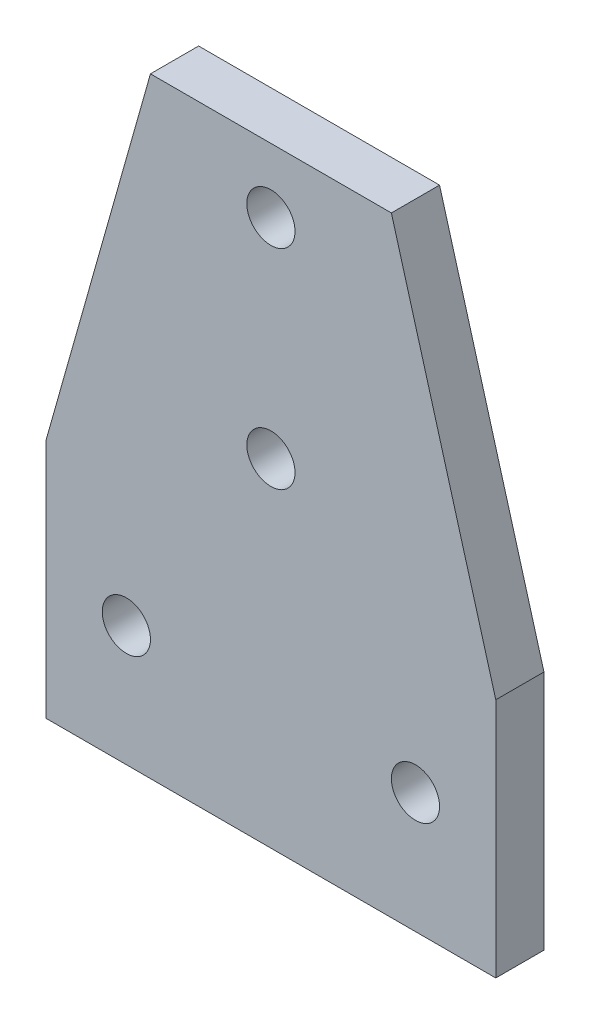
from build123d import *

# Parameters (mm, degrees)
EXTRUDE_1_DEPTH     = 3
SKETCH_2_R          = 1.5
CUT_EXTRUDE_1_DEPTH = 3
SKETCH_3_W          = 11
SKETCH_3_H          = 29.457142857
CUT_EXTRUDE_2_DEPTH = 3
SKETCH_4_W          = 11
SKETCH_4_H          = 29.457142857
CUT_EXTRUDE_3_DEPTH = 3
CUT_EXTRUDE_4_DEPTH = 3


with BuildPart() as part:
    # 草图1 → 凸台-拉伸1 (new body)
    with BuildSketch(Plane.XY):
        Polygon((0, 0), (15, 0), (32.5, -23), (32.5, -38), (-17.5, -38), (-17.5, -23), align=None)
    extrude(amount=EXTRUDE_1_DEPTH)

    # 草图2 → 切除-拉伸1 (cut)
    with BuildSketch(Plane.XY.offset(3)):
        with Locations((7.5, -4)):
            Circle(SKETCH_2_R)
        with Locations((7.5, -17)):
            Circle(SKETCH_2_R)
        with Locations((28.5, -30.5)):
            Circle(SKETCH_2_R)
        with Locations((16.5, -30.5)):
            Circle(SKETCH_2_R)
        with Locations((-1.5, -30.5)):
            Circle(SKETCH_2_R)
        with Locations((-13.5, -30.5)):
            Circle(SKETCH_2_R)
    extrude(amount=-CUT_EXTRUDE_1_DEPTH, mode=Mode.SUBTRACT)

    # 草图3 → 切除-拉伸2 (cut)
    with BuildSketch(Plane.XY.offset(3)):
        with Locations((27, -23.271428571)):
            Rectangle(SKETCH_3_W, SKETCH_3_H)
    extrude(amount=-CUT_EXTRUDE_2_DEPTH, mode=Mode.SUBTRACT)

    # 草图4 → 切除-拉伸3 (cut)
    with BuildSketch(Plane.XY.offset(3)):
        with Locations((-12, -23.271428571)):
            Rectangle(SKETCH_4_W, SKETCH_4_H)
    extrude(amount=-CUT_EXTRUDE_3_DEPTH, mode=Mode.SUBTRACT)

    # 草图5 → 切除-拉伸4 (cut)
    with BuildSketch(Plane.XY.offset(3)):
        Polygon((-6.5, -23), (-6.5, -8.542857143), (0, 0), align=None)
        Polygon((21.5, -23), (21.5, -8.542857143), (15, 0), align=None)
    extrude(amount=-CUT_EXTRUDE_4_DEPTH, mode=Mode.SUBTRACT)


solid = part.part
